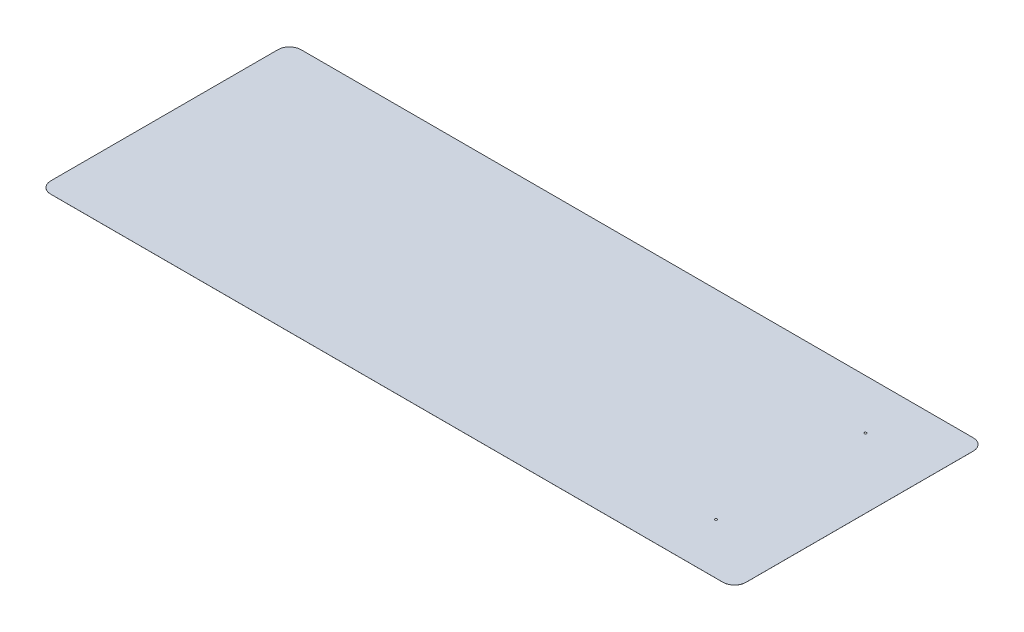
from build123d import *

# Parameters (mm, degrees)
BOSS_EXTRUDE1_DEPTH = 0.127
SKETCH2_R           = 3.175
CUT_EXTRUDE1_DEPTH  = 1013.269581013


with BuildPart() as part:
    # Sketch1 → Boss-Extrude1 (new body)
    with BuildSketch(Plane(origin=(0, 0, 0), x_dir=(1, 0, 0), z_dir=(0, 1, 0))):
        with BuildLine():
            Line((-920.75, -342.843269291), (920.75, -342.843269291))
            ThreePointArc((920.75, -342.843269291), (943.160525634, -333.560525634), (952.443269291, -311.15))
            Line((952.443269291, -311.15), (952.443269291, 311.15))
            ThreePointArc((952.443269291, 311.15), (943.160525634, 333.560525634), (920.75, 342.843269291))
            Line((920.75, 342.843269291), (-920.75, 342.843269291))
            ThreePointArc((-920.75, 342.843269291), (-943.160525634, 333.560525634), (-952.443269291, 311.15))
            Line((-952.443269291, 311.15), (-952.443269291, -311.15))
            ThreePointArc((-952.443269291, -311.15), (-943.160525634, -333.560525634), (-920.75, -342.843269291))
        make_face()
    extrude(amount=BOSS_EXTRUDE1_DEPTH)

    # Sketch2 → Cut-Extrude1 (cut, through all)
    with BuildSketch(Plane(origin=(0, 0.127, 0), x_dir=(1, 0, 0), z_dir=(0, 1, 0))):
        with Locations(Location((762, 206.329615433, 0), (0, 0, 270))):
            Circle(SKETCH2_R)
        with Locations(Location((762, -203.211346142, 0), (0, 0, 270))):
            Circle(SKETCH2_R)
    extrude(amount=-CUT_EXTRUDE1_DEPTH, mode=Mode.SUBTRACT)


solid = part.part
